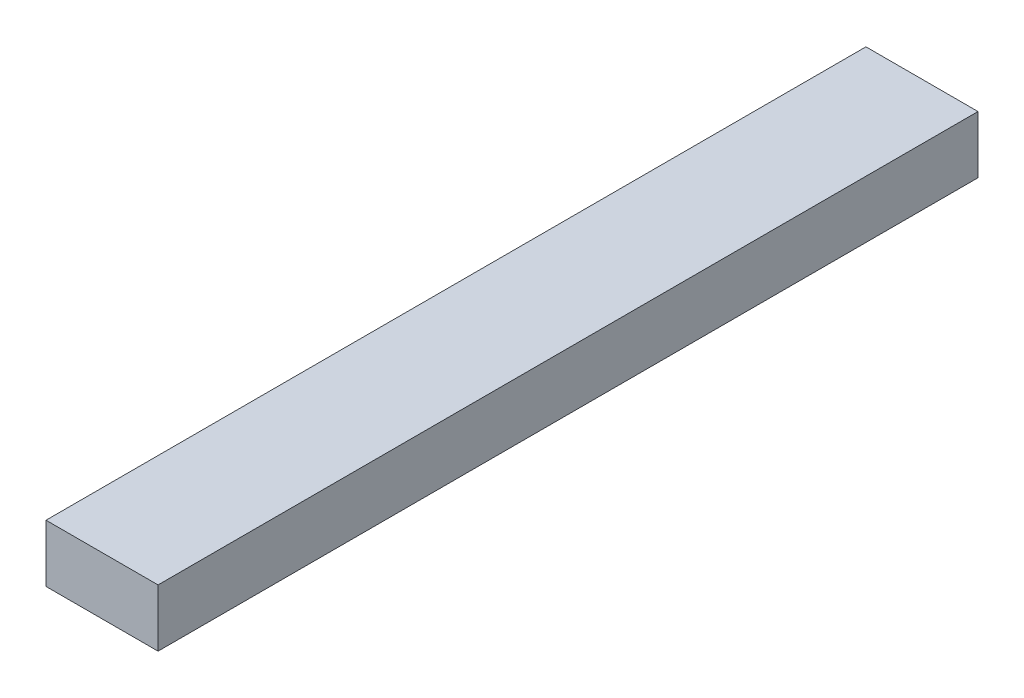
from build123d import *

# Parameters (mm, degrees)
SKETCH1_W           = 41
SKETCH1_H           = 21
BOSS_EXTRUDE1_DEPTH = 300


with BuildPart() as part:
    # Sketch1 → Boss-Extrude1 (new body)
    with BuildSketch(Plane.XY):
        Rectangle(SKETCH1_W, SKETCH1_H)
    extrude(amount=BOSS_EXTRUDE1_DEPTH)


solid = part.part
